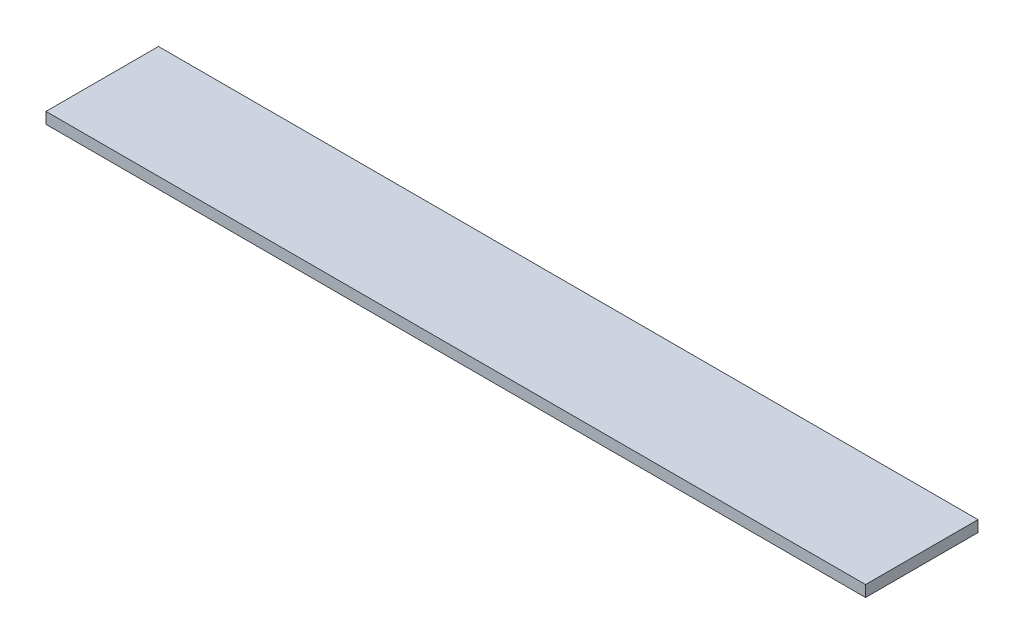
from build123d import *

# Parameters (mm, degrees)
SKETCH1_W           = 145.75
SKETCH1_H           = 20
BOSS_EXTRUDE1_DEPTH = 2


with BuildPart() as part:
    # Sketch1 → Boss-Extrude1 (new body)
    with BuildSketch(Plane(origin=(0, 0, 0), x_dir=(1, 0, 0), z_dir=(0, 1, 0))):
        Rectangle(SKETCH1_W, SKETCH1_H)
    extrude(amount=BOSS_EXTRUDE1_DEPTH)


solid = part.part
